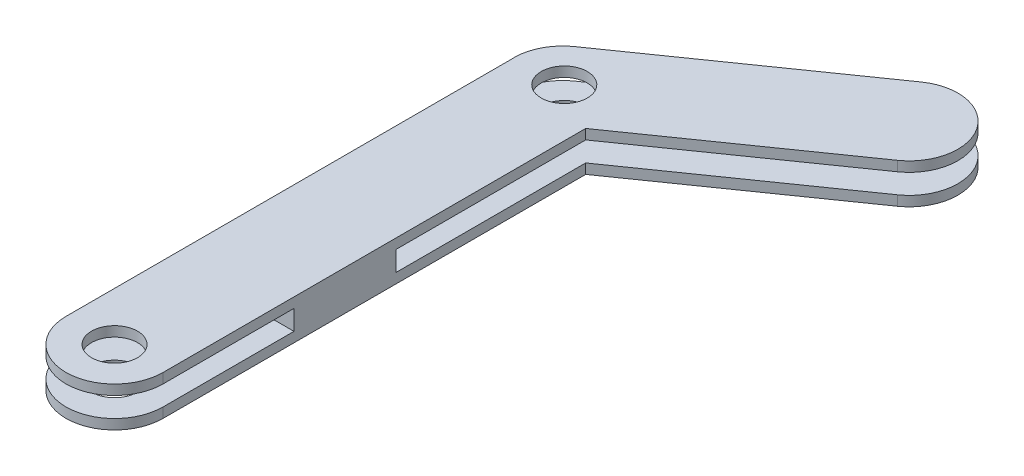
from build123d import *

# Parameters (mm, degrees)
EXTRUDE_1_DEPTH     = 4
SKETCH_3_R          = 9.242846329
CUT_EXTRUDE_2_DEPTH = 8
SKETCH_5_W          = 39
SKETCH_5_H          = 40.905653917
EXTRUDE_2_DEPTH     = 4
EXTRUDE_3_DEPTH     = 4
SKETCH_8_R          = 9.245
CUT_EXTRUDE_3_DEPTH = 4


with BuildPart() as part:
    # 草图2 → 凸台-拉伸1 (new body)
    with BuildSketch(Plane(origin=(0, 0, 0), x_dir=(1, 0, 0), z_dir=(0, 1, 0))):
        with BuildLine():
            Line((-19.5, 0), (-19.5, 180))
            ThreePointArc((-19.5, 180), (0, 199.5), (19.5, 180))
            Line((19.5, 180), (19.5, 0))
            ThreePointArc((19.5, 0), (0, -19.5), (-19.5, 0))
        make_face()
    extrude_1 = extrude(amount=EXTRUDE_1_DEPTH)

    # 草图3 → 切除-拉伸2 (cut)
    with BuildSketch(Plane(origin=(0, 4, 0), x_dir=(-1, 0, 0), z_dir=(0, 1, 0))):
        with Locations(Location((0, -180, 0), (0, 0, 90))):
            Circle(SKETCH_3_R)
        with Locations(Location((0, 0, 0), (0, 0, 90))):
            Circle(SKETCH_3_R)
    cut_extrude_2 = extrude(amount=-CUT_EXTRUDE_2_DEPTH, mode=Mode.SUBTRACT)

    # 草图5 → 凸台-拉伸2 (add)
    with BuildSketch(Plane(origin=(0, 0, 0), x_dir=(1, 0, 0), z_dir=(0, 1, 0))):
        with Locations((0, 73.039937417)):
            Rectangle(SKETCH_5_W, SKETCH_5_H)
    extrude_2 = extrude(amount=-EXTRUDE_2_DEPTH)

    # 镜向3: 凸台-拉伸1, 切除-拉伸2, 凸台-拉伸2 across plane
    add(extrude_1.mirror(Plane(origin=(0, -4, 0), x_dir=(0, 0, 1), z_dir=(0, -1, 0))))
    add(cut_extrude_2.mirror(Plane(origin=(0, -4, 0), x_dir=(0, 0, 1), z_dir=(0, -1, 0))), mode=Mode.SUBTRACT)
    add(extrude_2.mirror(Plane(origin=(0, -4, 0), x_dir=(0, 0, 1), z_dir=(0, -1, 0))))

    # 草图7 → 凸台-拉伸3 (add)
    with BuildSketch(Plane.XZ.offset(12)):
        with BuildLine():
            Line((11.205673107, -163.975801314), (93.155923926, -221.283360943))
            ThreePointArc((93.155923926, -221.283360943), (97.974449505, -248.513232736), (70.744577713, -253.331758315))
            Line((70.744577713, -253.331758315), (-11.205673107, -196.024198686))
            ThreePointArc((-11.205673107, -196.024198686), (-16.024198686, -168.794326893), (11.205673107, -163.975801314))
        make_face()
    extrude_3 = extrude(amount=-EXTRUDE_3_DEPTH)

    # 草图8 → 切除-拉伸3 (cut)
    with BuildSketch(Plane.XZ.offset(12)):
        with Locations(Location((0, -180.667521799, 0), (0, 0, 270))):
            Circle(SKETCH_8_R)
    cut_extrude_3 = extrude(amount=-CUT_EXTRUDE_3_DEPTH, mode=Mode.SUBTRACT)

    # 镜向6: 凸台-拉伸3, 切除-拉伸3 across plane
    add(extrude_3.mirror(Plane(origin=(0, -4, 0), x_dir=(0, 0, 1), z_dir=(0, -1, 0))))
    add(cut_extrude_3.mirror(Plane(origin=(0, -4, 0), x_dir=(0, 0, 1), z_dir=(0, -1, 0))), mode=Mode.SUBTRACT)


solid = part.part
